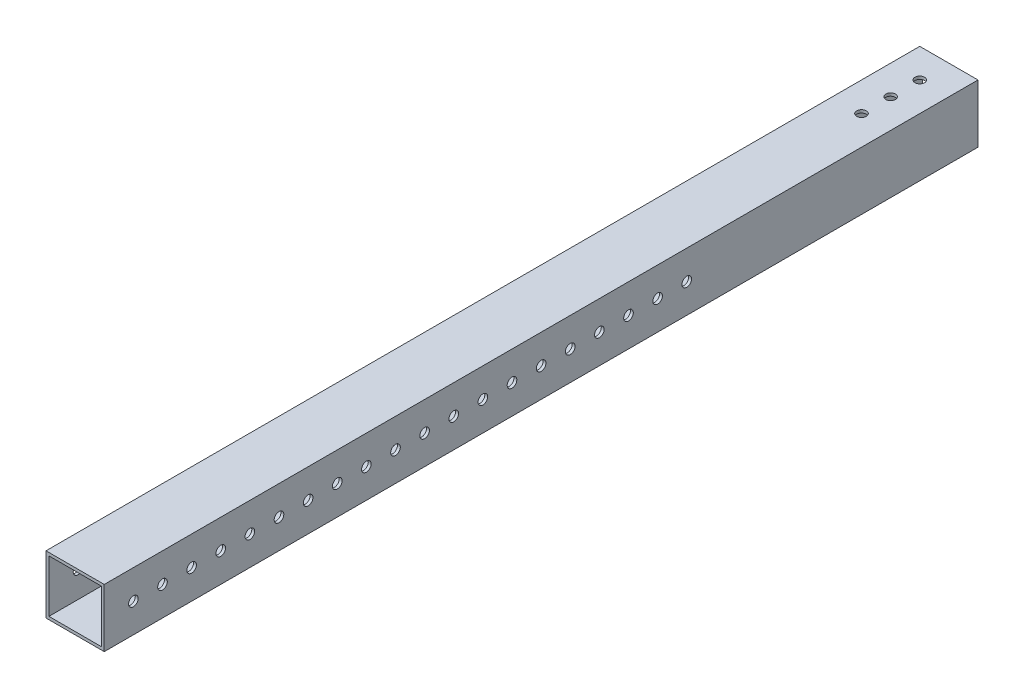
from build123d import *

# Parameters (mm, degrees)
SKETCH_1_W          = 20
SKETCH_1_H          = 20
SKETCH_1_W_2        = 18
SKETCH_1_H_2        = 18
EXTRUDE_1_DEPTH     = 300
SKETCH_2_R          = 1.65
CUT_EXTRUDE_1_DEPTH = 301.83217913
SKETCH_4_R          = 1.65
CUT_EXTRUDE_3_DEPTH = 180


with BuildPart() as part:
    # 草图1 → 凸台-拉伸1 (new body)
    with BuildSketch(Plane.XY):
        Rectangle(SKETCH_1_W, SKETCH_1_H)
        Rectangle(SKETCH_1_W_2, SKETCH_1_H_2, mode=Mode.SUBTRACT)
    extrude(amount=EXTRUDE_1_DEPTH)

    # 草图2 → 切除-拉伸1 (cut, through all)
    with BuildSketch(Plane(origin=(0, 10, 0), x_dir=(1, 0, 0), z_dir=(0, 1, 0))):
        with Locations(Location((0, -10, 0), (0, 0, 270))):
            Circle(SKETCH_2_R)
        with Locations(Location((0, -20, 0), (0, 0, 270))):
            Circle(SKETCH_2_R)
        with Locations(Location((0, -30, 0), (0, 0, 270))):
            Circle(SKETCH_2_R)
    extrude(amount=-CUT_EXTRUDE_1_DEPTH, mode=Mode.SUBTRACT)

    # 草图4 → 切除-拉伸3 (cut)
    with BuildSketch(Plane(origin=(10, 0, 0), x_dir=(0, 0, -1), z_dir=(1, 0, 0))):
        with Locations((-290, 0)):
            Circle(SKETCH_4_R)
        with Locations((-280, 0)):
            Circle(SKETCH_4_R)
        with Locations((-270, 0)):
            Circle(SKETCH_4_R)
        with Locations((-260, 0)):
            Circle(SKETCH_4_R)
        with Locations((-250, 0)):
            Circle(SKETCH_4_R)
        with Locations((-240, 0)):
            Circle(SKETCH_4_R)
        with Locations((-230, 0)):
            Circle(SKETCH_4_R)
        with Locations((-220, 0)):
            Circle(SKETCH_4_R)
        with Locations((-210, 0)):
            Circle(SKETCH_4_R)
        with Locations((-200, 0)):
            Circle(SKETCH_4_R)
        with Locations((-190, 0)):
            Circle(SKETCH_4_R)
        with Locations((-180, 0)):
            Circle(SKETCH_4_R)
        with Locations((-170, 0)):
            Circle(SKETCH_4_R)
        with Locations((-160, 0)):
            Circle(SKETCH_4_R)
        with Locations((-150, 0)):
            Circle(SKETCH_4_R)
        with Locations((-140, 0)):
            Circle(SKETCH_4_R)
        with Locations((-130, 0)):
            Circle(SKETCH_4_R)
        with Locations((-120, 0)):
            Circle(SKETCH_4_R)
        with Locations((-110, 0)):
            Circle(SKETCH_4_R)
        with Locations((-100, 0)):
            Circle(SKETCH_4_R)
    extrude(amount=-CUT_EXTRUDE_3_DEPTH, mode=Mode.SUBTRACT)


solid = part.part
